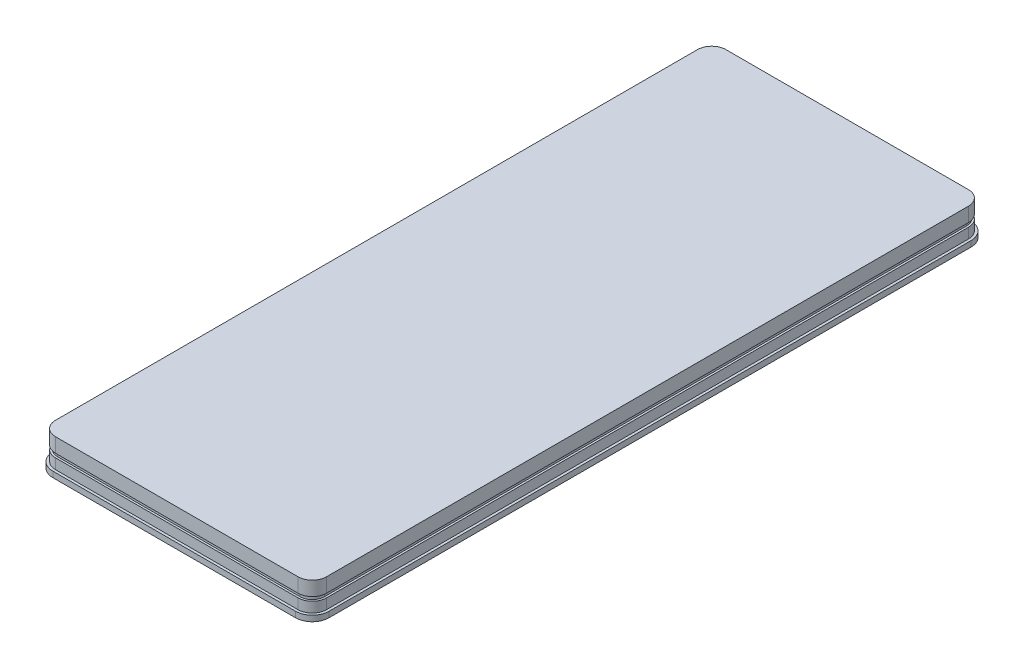
from build123d import *

# Parameters (mm, degrees)
BOSS_EXTRUDE1_DEPTH = 10
BOSS_EXTRUDE2_DEPTH = 2
CUT_EXTRUDE1_START  = -6.4
CUT_EXTRUDE1_DEPTH  = 1.4


with BuildPart() as part:
    # Sketch1 → Boss-Extrude1 (new body)
    with BuildSketch(Plane(origin=(0, 0, 0), x_dir=(1, 0, 0), z_dir=(0, 1, 0))):
        with BuildLine():
            Line((-42.5, -117.5), (42.5, -117.5))
            ThreePointArc((42.5, -117.5), (46.035533906, -116.035533906), (47.5, -112.5))
            Line((47.5, -112.5), (47.5, 112.5))
            ThreePointArc((47.5, 112.5), (46.035533906, 116.035533906), (42.5, 117.5))
            Line((42.5, 117.5), (-42.5, 117.5))
            ThreePointArc((-42.5, 117.5), (-46.035533906, 116.035533906), (-47.5, 112.5))
            Line((-47.5, 112.5), (-47.5, -112.5))
            ThreePointArc((-47.5, -112.5), (-46.035533906, -116.035533906), (-42.5, -117.5))
        make_face()
    extrude(amount=BOSS_EXTRUDE1_DEPTH)

    # Sketch2 → Boss-Extrude2 (add)
    with BuildSketch(Plane.XZ):
        with BuildLine():
            Line((-48.4, 112.5), (-48.4, -112.5))
            ThreePointArc((-48.4, -112.5), (-46.671930009, -116.671930009), (-42.5, -118.4))
            Line((-42.5, -118.4), (42.5, -118.4))
            ThreePointArc((42.5, -118.4), (46.671930009, -116.671930009), (48.4, -112.5))
            Line((48.4, -112.5), (48.4, 112.5))
            ThreePointArc((48.4, 112.5), (46.671930009, 116.671930009), (42.5, 118.4))
            Line((42.5, 118.4), (-42.5, 118.4))
            ThreePointArc((-42.5, 118.4), (-46.671930009, 116.671930009), (-48.4, 112.5))
        make_face()
    extrude(amount=BOSS_EXTRUDE2_DEPTH)

    # Sketch3 → Cut-Extrude1 (cut)
    with BuildSketch(Plane(origin=(0, 10, 0), x_dir=(1, 0, 0), z_dir=(0, 1, 0)).offset(CUT_EXTRUDE1_START)):
        with BuildLine():
            Line((-47.5, 112.5), (-47.5, -112.5))
            ThreePointArc((-47.5, -112.5), (-46.035533906, -116.035533906), (-42.5, -117.5))
            Line((-42.5, -117.5), (42.5, -117.5))
            ThreePointArc((42.5, -117.5), (46.035533906, -116.035533906), (47.5, -112.5))
            Line((47.5, -112.5), (47.5, 112.5))
            ThreePointArc((47.5, 112.5), (46.035533906, 116.035533906), (42.5, 117.5))
            Line((42.5, 117.5), (-42.5, 117.5))
            ThreePointArc((-42.5, 117.5), (-46.035533906, 116.035533906), (-47.5, 112.5))
        make_face()
        with BuildLine():
            ThreePointArc((-42.5, 116.8), (-45.540559159, 115.540559159), (-46.8, 112.5))
            Line((-46.8, 112.5), (-46.8, -112.5))
            ThreePointArc((-46.8, -112.5), (-45.540559159, -115.540559159), (-42.5, -116.8))
            Line((-42.5, -116.8), (42.5, -116.8))
            ThreePointArc((42.5, -116.8), (45.540559159, -115.540559159), (46.8, -112.5))
            Line((46.8, -112.5), (46.8, 112.5))
            ThreePointArc((46.8, 112.5), (45.540559159, 115.540559159), (42.5, 116.8))
            Line((42.5, 116.8), (-42.5, 116.8))
        make_face(mode=Mode.SUBTRACT)
    extrude(amount=CUT_EXTRUDE1_DEPTH, mode=Mode.SUBTRACT)


solid = part.part
